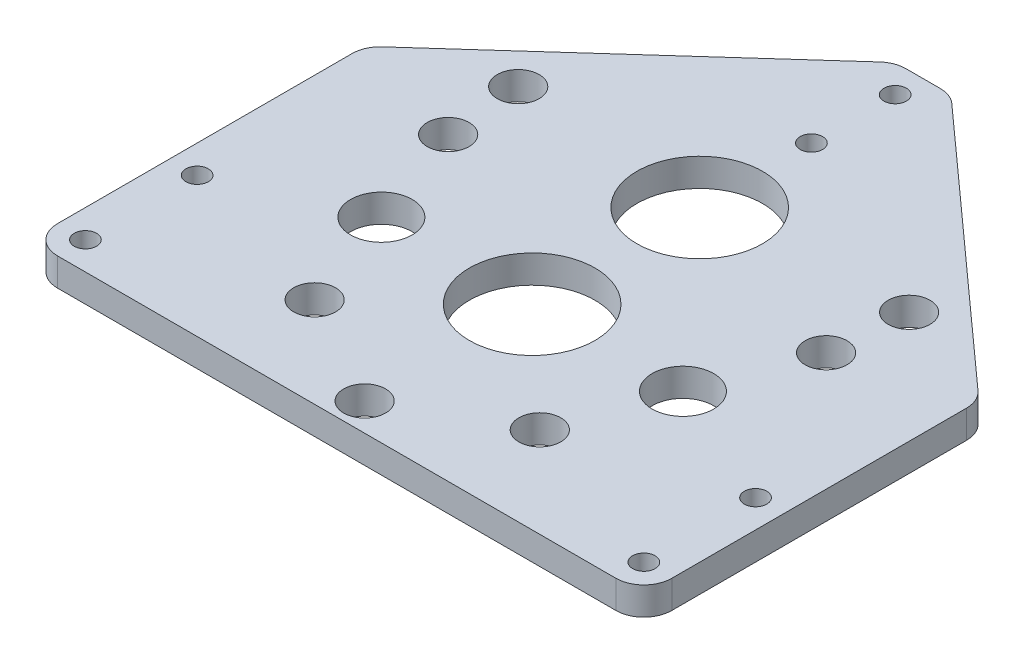
from build123d import *

# Parameters (mm, degrees)
BOSS_EXTRUDE1_DEPTH        = 6.35
SKETCH2_R                  = 7
MOTOR_BEARING_HOLES_DEPTH  = 135.10382172
SKETCH3_R                  = 14.2875
CUT_EXTRUDE1_DEPTH         = 135.10382172
SKETCH4_R                  = 14.2875
CUT_EXTRUDE2_DEPTH         = 135.10382172
SKETCH5_R                  = 4.7625
CUT_EXTRUDE3_DEPTH         = 50.8
F_10_CLEARANCE_HOLE1_D     = 5.1054
F_10_CLEARANCE_HOLE2_D     = 5.1054
F_10_CLEARANCE_HOLE2_DEPTH = 50.8
F_10_CLEARANCE_HOLE2_TIP   = 1.533816902
FILLET1_R                  = 6.35
SKETCH10_R                 = 4.7625
CUT_EXTRUDE4_DEPTH         = 50.8


with BuildPart() as part:
    # Sketch1 → Boss-Extrude1 (new body)
    with BuildSketch(Plane(origin=(0, 0, 0), x_dir=(1, 0, 0), z_dir=(0, 1, 0))):
        Polygon((-69.85, -19.05), (69.85, -19.05), (69.85, 57.15), (6.35, 114.3), (-6.35, 114.3), (-69.85, 57.15), align=None)
    extrude(amount=BOSS_EXTRUDE1_DEPTH)

    # Sketch2 → Motor Bearing Holes (cut, through all)
    with BuildSketch(Plane(origin=(0, 6.35, 0), x_dir=(1, 0, 0), z_dir=(0, 1, 0))):
        with Locations(Location((-34.29, 25.4, 0), (0, 0, 270))):
            Circle(SKETCH2_R)
        with Locations(Location((34.29, 25.4, 0), (0, 0, 270))):
            Circle(SKETCH2_R)
    extrude(amount=-MOTOR_BEARING_HOLES_DEPTH, mode=Mode.SUBTRACT)

    # Sketch3 → Cut-Extrude1 (cut, through all)
    with BuildSketch(Plane(origin=(0, 6.35, 0), x_dir=(1, 0, 0), z_dir=(0, 1, 0))):
        with Locations(Location((0, 25.4, 0), (0, 0, 270))):
            Circle(SKETCH3_R)
    extrude(amount=-CUT_EXTRUDE1_DEPTH, mode=Mode.SUBTRACT)

    # Sketch4 → Cut-Extrude2 (cut, through all)
    with BuildSketch(Plane(origin=(0, 6.35, 0), x_dir=(1, 0, 0), z_dir=(0, 1, 0))):
        with Locations(Location((0, 63.5, 0), (0, 0, 270))):
            Circle(SKETCH4_R)
    extrude(amount=-CUT_EXTRUDE2_DEPTH, mode=Mode.SUBTRACT)

    # Sketch5 → Cut-Extrude3 (cut)
    with BuildSketch(Plane(origin=(0, 38.1, 19.05), x_dir=(-0.9584281674521108, 0, 0.2853339233851958), z_dir=(0, 1, 0))):
        with Locations(Location((21.697168114, -77.740965053, 0), (0, 0, 73.42119018))):
            Circle(SKETCH5_R)
        with Locations(Location((18.665649821, -27.031499499, 0), (0, 0, 73.42119018))):
            Circle(SKETCH5_R)
        with Locations(Location((-30.411025551, -12.420868461, 0), (0, 0, 73.42119018))):
            Circle(SKETCH5_R)
        with Locations(Location((-60.684163962, -53.21519516, 0), (0, 0, 73.42119018))):
            Circle(SKETCH5_R)
    extrude(amount=-CUT_EXTRUDE3_DEPTH, mode=Mode.SUBTRACT)

    # #10 Clearance Hole1 (through all)
    with Locations(Plane(origin=(0, 6.35, 19.05), x_dir=(1, 0, 0), z_dir=(0, 1, 0))):
        with Locations((-63.5, 6.35), (63.5, 6.35), (0, 107.95)):
            Hole(F_10_CLEARANCE_HOLE1_D / 2)

    # #10 Clearance Hole2
    with Locations(Plane(origin=(0, 38.1, 19.05), x_dir=(1, 0, 0), z_dir=(0, 1, 0))):
        with Locations((-63.5, 31.75), (63.5, 31.75), (0, 127)):
            Hole(F_10_CLEARANCE_HOLE2_D / 2, depth=F_10_CLEARANCE_HOLE2_DEPTH)
            with Locations((0, 0, -(F_10_CLEARANCE_HOLE2_DEPTH + F_10_CLEARANCE_HOLE2_TIP / 2))):  # 118° drill point
                Cone(0, F_10_CLEARANCE_HOLE2_D / 2, F_10_CLEARANCE_HOLE2_TIP, mode=Mode.SUBTRACT)

    # Fillet1
    fillet1_edges = [part.edges().sort_by_distance(p)[0] for p in [
        (-69.85, 3.175, -57.15),
        (-6.35, 3.175, -114.3),
        (6.35, 3.175, -114.3),
        (69.85, 3.175, -57.15),
        (69.85, 3.175, 19.05),
        (-69.85, 3.175, 19.05),
    ]]
    fillet(fillet1_edges, radius=FILLET1_R)

    # Sketch10 → Cut-Extrude4 (cut)
    with BuildSketch(Plane(origin=(0, -28.575, 19.05), x_dir=(-1, 0, 0), z_dir=(0, -1, 0))):
        with Locations(Location((-44.45, 85.725, 0), (0, 0, 270))):
            Circle(SKETCH10_R)
        with Locations(Location((44.45, 85.725, 0), (0, 0, 270))):
            Circle(SKETCH10_R)
        with Locations(Location((0, 6.35, 0), (0, 0, 270))):
            Circle(SKETCH10_R)
    extrude(amount=-CUT_EXTRUDE4_DEPTH, mode=Mode.SUBTRACT)


solid = part.part
